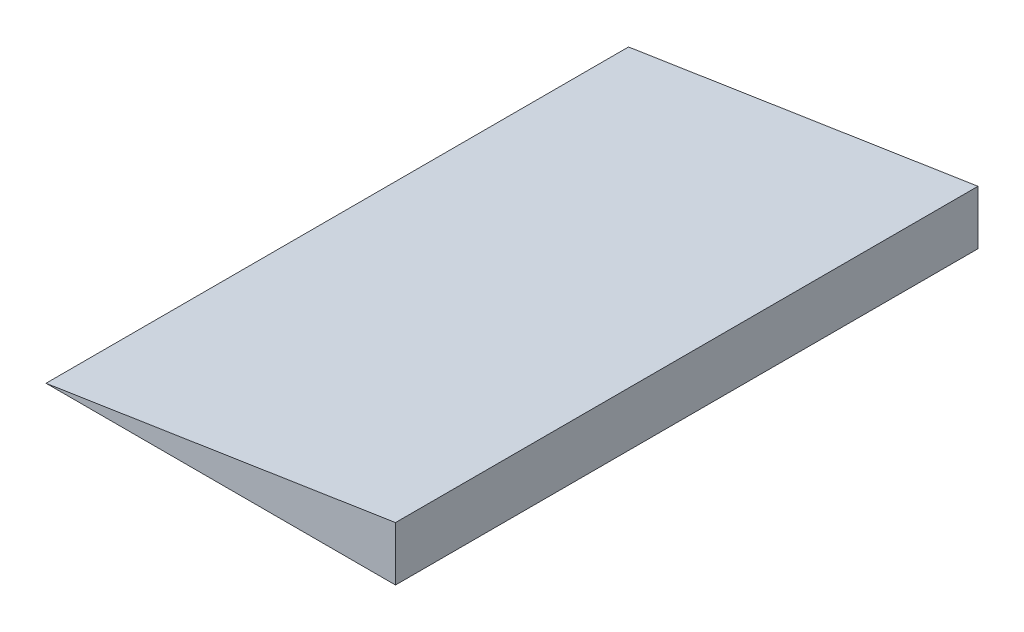
from build123d import *

# Parameters (mm, degrees)
BOSS_EXTRUDE1_DEPTH = 50


with BuildPart() as part:
    # Sketch1 → Boss-Extrude1 (new body)
    with BuildSketch(Plane.XY):
        Polygon((0, 0), (30, 4.644245374), (30, 0), align=None)
    extrude(amount=BOSS_EXTRUDE1_DEPTH)


solid = part.part
